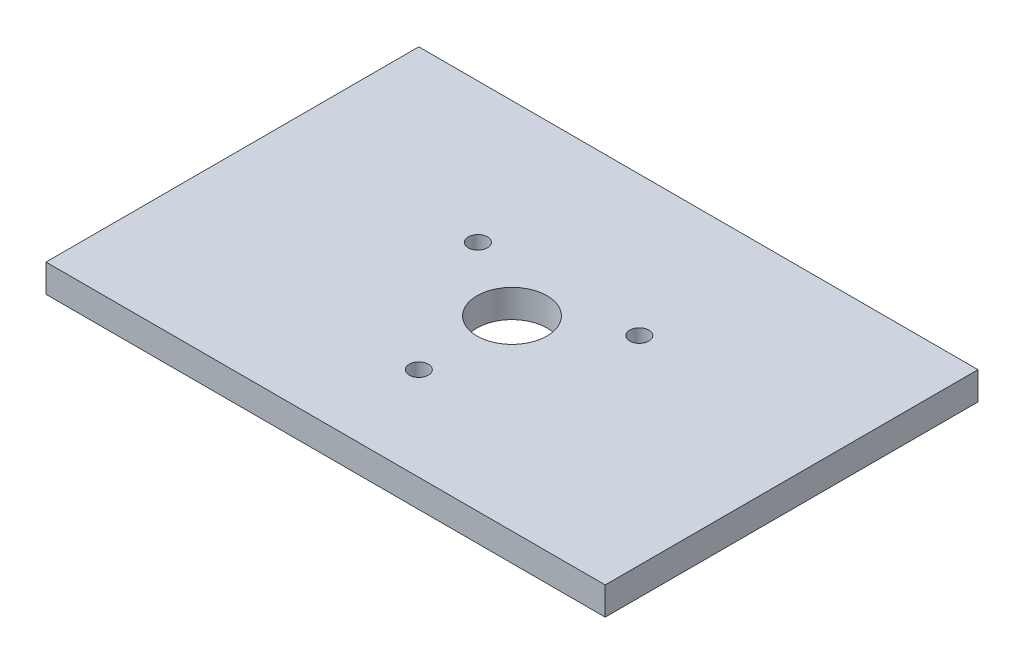
from build123d import *

# Parameters (mm, degrees)
SKETCH_1_W              = 120
SKETCH_1_H              = 80
EXTRUDE_1_DEPTH         = 6
SKETCH_3_R              = 2.05
CUT_EXTRUDE_4_1_1_DEPTH = 5
SKETCH_4_R              = 2.05
CUT_EXTRUDE_4_1_2_DEPTH = 5
SKETCH_5_R              = 4
CUT_EXTRUDE_3_DEPTH     = 3
SKETCH_6_R              = 7.5
CUT_EXTRUDE_4_DEPTH     = 10


with BuildPart() as part:
    # 草图1 → 凸台-拉伸1 (new body)
    with BuildSketch(Plane(origin=(0, 0, 0), x_dir=(1, 0, 0), z_dir=(0, 1, 0))):
        Rectangle(SKETCH_1_W, SKETCH_1_H)
    extrude(amount=EXTRUDE_1_DEPTH)

    # 草图3 → φ4.1孔1 (cut)
    with BuildSketch(Plane(origin=(0, 6, 0), x_dir=(1, 0, 0), z_dir=(0, 1, 0))):
        with Locations(Location((0, -20, 0), (0, 0, 270))):
            Circle(SKETCH_3_R)
        with Locations(Location((-17.320508076, 10, 0), (0, 0, 270))):
            Circle(SKETCH_3_R)
        with Locations(Location((17.320508076, 10, 0), (0, 0, 270))):
            Circle(SKETCH_3_R)
    extrude(amount=-CUT_EXTRUDE_4_1_1_DEPTH, mode=Mode.SUBTRACT)

    # 草图4 → φ4.1孔2 (cut)
    with BuildSketch(Plane.XZ):
        with Locations(Location((-16.454482672, 9.5, 0), (0, 0, 270))):
            Circle(SKETCH_4_R)
        with Locations(Location((16.454482672, 9.5, 0), (0, 0, 270))):
            Circle(SKETCH_4_R)
        with Locations(Location((0, -19, 0), (0, 0, 270))):
            Circle(SKETCH_4_R)
    extrude(amount=-CUT_EXTRUDE_4_1_2_DEPTH, mode=Mode.SUBTRACT)

    # 草图5 → 切除-拉伸3 (cut)
    with BuildSketch(Plane.XZ):
        with Locations(Location((-16.454482672, 9.5, 0), (0, 0, 270))):
            Circle(SKETCH_5_R)
        with Locations(Location((16.454482672, 9.5, 0), (0, 0, 270))):
            Circle(SKETCH_5_R)
        with Locations(Location((0, -19, 0), (0, 0, 270))):
            Circle(SKETCH_5_R)
    extrude(amount=-CUT_EXTRUDE_3_DEPTH, mode=Mode.SUBTRACT)

    # 草图6 → 切除-拉伸4 (cut)
    with BuildSketch(Plane.XZ):
        with Locations(Location((0, 0, 0), (0, 0, 270))):
            Circle(SKETCH_6_R)
    extrude(amount=-CUT_EXTRUDE_4_DEPTH, mode=Mode.SUBTRACT)


solid = part.part
